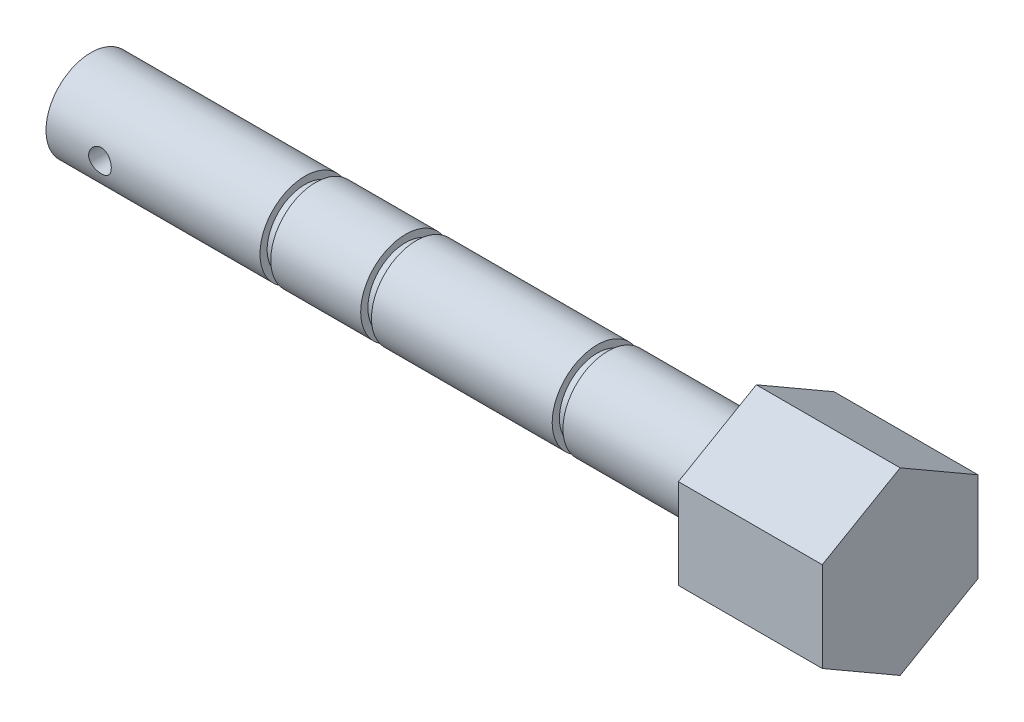
from build123d import *

# Parameters (mm, degrees)
SKETCH1_R           = 3.175
BOSS_EXTRUDE2_DEPTH = 46.99
BOSS_EXTRUDE3_DEPTH = 10.16
SKETCH3_R           = 3.175
SKETCH3_R_2         = 1.778
CUT_EXTRUDE1_DEPTH  = 19.05
SKETCH6_R           = 3.175
BOSS_EXTRUDE5_DEPTH = 49.022
CUT_EXTRUDE5_DEPTH  = 38.1
SKETCH9_R           = 0.866025404
CUT_EXTRUDE7_DEPTH  = 46.99
SKETCH10_R          = 0.8001
CUT_EXTRUDE8_DEPTH  = 5.334
CUT_EXTRUDE9_START  = 0.762
SKETCH11_R          = 3.175
SKETCH11_R_2        = 2.667
CUT_EXTRUDE9_DEPTH  = 0.762
CUT_EXTRUDE10_START = 0.762
SKETCH12_R          = 3.175
SKETCH12_R_2        = 2.667
CUT_EXTRUDE10_DEPTH = 0.762
CUT_EXTRUDE12_START = 0.762
SKETCH13_R          = 3.175
SKETCH13_R_2        = 2.667
CUT_EXTRUDE12_DEPTH = 0.762


with BuildPart() as part:
    # Sketch1 → Boss-Extrude2 (new body)
    with BuildSketch(Plane(origin=(0, 0, 0), x_dir=(0, 0, -1), z_dir=(1, 0, 0))):
        Circle(SKETCH1_R)
    extrude(amount=BOSS_EXTRUDE2_DEPTH)

    # Sketch2 → Boss-Extrude3 (add)
    with BuildSketch(Plane(origin=(46.99, 0, 0), x_dir=(0, 0, -1), z_dir=(1, 0, 0))):
        Polygon((-5.499261314, 3.175), (-5.499261314, -3.175), (0, -6.35), (5.499261314, -3.175), (5.499261314, 3.175), (0, 6.35), align=None)
    extrude(amount=BOSS_EXTRUDE3_DEPTH)

    # Sketch3 → Cut-Extrude1 (cut)
    with BuildSketch(Plane.ZY):
        Circle(SKETCH3_R)
        Circle(SKETCH3_R_2, mode=Mode.SUBTRACT)
    extrude(amount=-CUT_EXTRUDE1_DEPTH, mode=Mode.SUBTRACT)

    # Sketch6 → Boss-Extrude5 (add)
    with BuildSketch(Plane.ZY):
        Circle(SKETCH6_R)
    extrude(amount=-BOSS_EXTRUDE5_DEPTH)

    # Sketch7 → Cut-Extrude5 (cut)
    with BuildSketch(Plane.ZY):
        Polygon((-0.489261374, 0.714579112), (-0.863474351, -0.066423223), (-0.374212977, -0.781002335), (0.489261374, -0.714579112), (0.863474351, 0.066423223), (0.374212977, 0.781002335), align=None)
    extrude(amount=-CUT_EXTRUDE5_DEPTH, mode=Mode.SUBTRACT)

    # Sketch9 → Cut-Extrude7 (cut)
    with BuildSketch(Plane.ZY):
        Circle(SKETCH9_R)
    extrude(amount=-CUT_EXTRUDE7_DEPTH, mode=Mode.SUBTRACT)

    # Sketch10 → Cut-Extrude8 (cut)
    with BuildSketch(Plane.XY.offset(5.499261314)):
        with Locations((3.81, 0)):
            Circle(SKETCH10_R)
    extrude(amount=-CUT_EXTRUDE8_DEPTH, mode=Mode.SUBTRACT)

    # Sketch11 → Cut-Extrude9 (cut)
    with BuildSketch(Plane.ZY.offset(-36.5125).offset(CUT_EXTRUDE9_START)):
        Circle(SKETCH11_R)
        with Locations(Location((0, 0, 0), (0, 0, 180))):
            Circle(SKETCH11_R_2, mode=Mode.SUBTRACT)
    extrude(amount=-CUT_EXTRUDE9_DEPTH, mode=Mode.SUBTRACT)

    # Sketch12 → Cut-Extrude10 (cut)
    with BuildSketch(Plane.ZY.offset(-15.875).offset(CUT_EXTRUDE10_START)):
        Circle(SKETCH12_R)
        with Locations(Location((0, 0, 0), (0, 0, 180))):
            Circle(SKETCH12_R_2, mode=Mode.SUBTRACT)
    extrude(amount=-CUT_EXTRUDE10_DEPTH, mode=Mode.SUBTRACT)

    # Sketch13 → Cut-Extrude12 (cut)
    with BuildSketch(Plane.ZY.offset(-22.987).offset(CUT_EXTRUDE12_START)):
        Circle(SKETCH13_R)
        with Locations(Location((0, 0, 0), (0, 0, 180))):
            Circle(SKETCH13_R_2, mode=Mode.SUBTRACT)
    extrude(amount=-CUT_EXTRUDE12_DEPTH, mode=Mode.SUBTRACT)


solid = part.part
